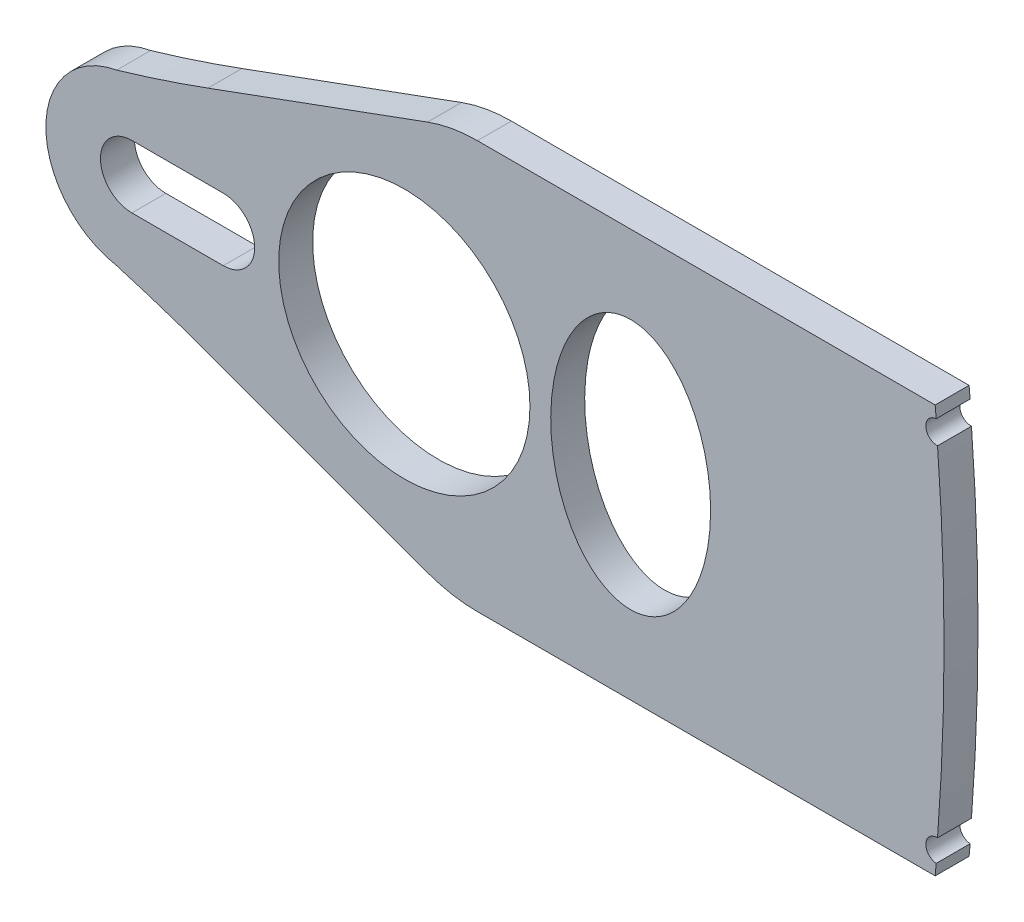
from build123d import *

# Parameters (mm, degrees)
SKETCH1_R           = 11.1010859
SKETCH1_RX          = 11.1010859
SKETCH1_RY          = 7.064327391
BOSS_EXTRUDE1_DEPTH = 3


with BuildPart() as part:
    # Sketch1 → Boss-Extrude1 (new body)
    with BuildSketch(Plane.XY):
        with BuildLine():
            Line((-17.894214973, -7.255421854), (1.504545567, -14.356753838))
            ThreePointArc((1.504545567, -14.356753838), (3.673142738, -14.941061094), (5.91044133, -15.137844409))
            Line((5.91044133, -15.137844409), (28.826197236, -15.137844409))
            Line((28.826197236, -15.137844409), (46.358712744, -15.137844409))
            ThreePointArc((46.358712744, -15.137844409), (46.404537835, -14.634718136), (46.449065208, -14.131475353))
            ThreePointArc((46.449065208, -14.131475353), (45.733406698, -13.729506595), (45.553147083, -12.928724192))
            ThreePointArc((45.553147083, -12.928724192), (45.913364237, -12.337750174), (46.569590651, -12.117810222))
            ThreePointArc((46.569590651, -12.117810222), (47.144860113, 2.882189778), (46.569590651, 17.882189778))
            ThreePointArc((46.569590651, 17.882189778), (45.913364237, 18.102129729), (45.553147083, 18.693103748))
            ThreePointArc((45.553147083, 18.693103748), (45.733406698, 19.49388615), (46.449065208, 19.895854908))
            ThreePointArc((46.449065208, 19.895854908), (46.404537835, 20.399097691), (46.358712744, 20.902223964))
            Line((46.358712744, 20.902223964), (28.826197236, 20.902223964))
            Line((28.826197236, 20.902223964), (5.91044133, 20.902223964))
            ThreePointArc((5.91044133, 20.902223964), (3.673142738, 20.70544065), (1.504545567, 20.121133393))
            Line((1.504545567, 20.121133393), (-17.894214973, 13.019801409))
            ThreePointArc((-17.894214973, 13.019801409), (-21.907637047, 11.625593721), (-25.965065064, 10.365177235))
            ThreePointArc((-25.965065064, 10.365177235), (-32.222134734, 2.882189778), (-25.965065064, -4.60079768))
            ThreePointArc((-25.965065064, -4.60079768), (-21.907637047, -5.861214166), (-17.894214973, -7.255421854))
        make_face()
        with Locations((-0.54553615, 2.882189778)):
            Circle(SKETCH1_R, mode=Mode.SUBTRACT)
        with Locations(Location((19.45446385, 2.882189778), (0, 0, -90))):
            Ellipse(SKETCH1_RX, SKETCH1_RY, mode=Mode.SUBTRACT)
        with BuildLine():
            Line((-16.54553615, 0.106918303), (-24.619053168, 0.106918303))
            ThreePointArc((-24.619053168, 0.106918303), (-27.394324643, 2.882189778), (-24.619053168, 5.657461252))
            Line((-24.619053168, 5.657461252), (-16.54553615, 5.657461252))
            ThreePointArc((-16.54553615, 5.657461252), (-13.770264675, 2.882189778), (-16.54553615, 0.106918303))
        make_face(mode=Mode.SUBTRACT)
    extrude(amount=BOSS_EXTRUDE1_DEPTH)


solid = part.part
